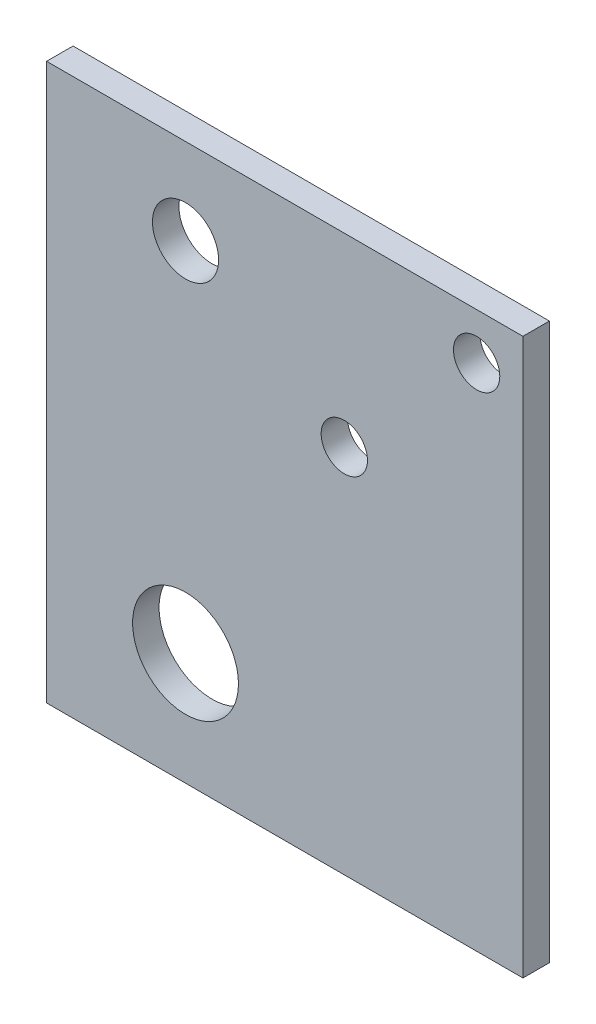
from build123d import *

# Parameters (mm, degrees)
SKETCH_1_W          = 36
SKETCH_1_H          = 42
EXTRUDE_1_DEPTH     = 2
SKETCH_2_R          = 1.75
SKETCH_2_R_2        = 2.5
CUT_EXTRUDE_1_DEPTH = 56.353410012
SKETCH_3_R          = 4
CUT_EXTRUDE_2_DEPTH = 56.353410012


with BuildPart() as part:
    # 草图1 → 凸台-拉伸1 (new body)
    with BuildSketch(Plane.XY):
        with Locations((18, 21)):
            Rectangle(SKETCH_1_W, SKETCH_1_H)
    extrude(amount=EXTRUDE_1_DEPTH)

    # 草图2 → 切除-拉伸1 (cut, through all)
    with BuildSketch(Plane.XY.offset(2)):
        with Locations((32.5, 38.5)):
            Circle(SKETCH_2_R)
        with Locations((22.5, 28)):
            Circle(SKETCH_2_R)
        with Locations((10.5, 35.5)):
            Circle(SKETCH_2_R_2)
    extrude(amount=-CUT_EXTRUDE_1_DEPTH, mode=Mode.SUBTRACT)

    # 草图3 → 切除-拉伸2 (cut, through all)
    with BuildSketch(Plane.XY.offset(2)):
        with Locations((10.5, 8.5)):
            Circle(SKETCH_3_R)
    extrude(amount=-CUT_EXTRUDE_2_DEPTH, mode=Mode.SUBTRACT)


solid = part.part
